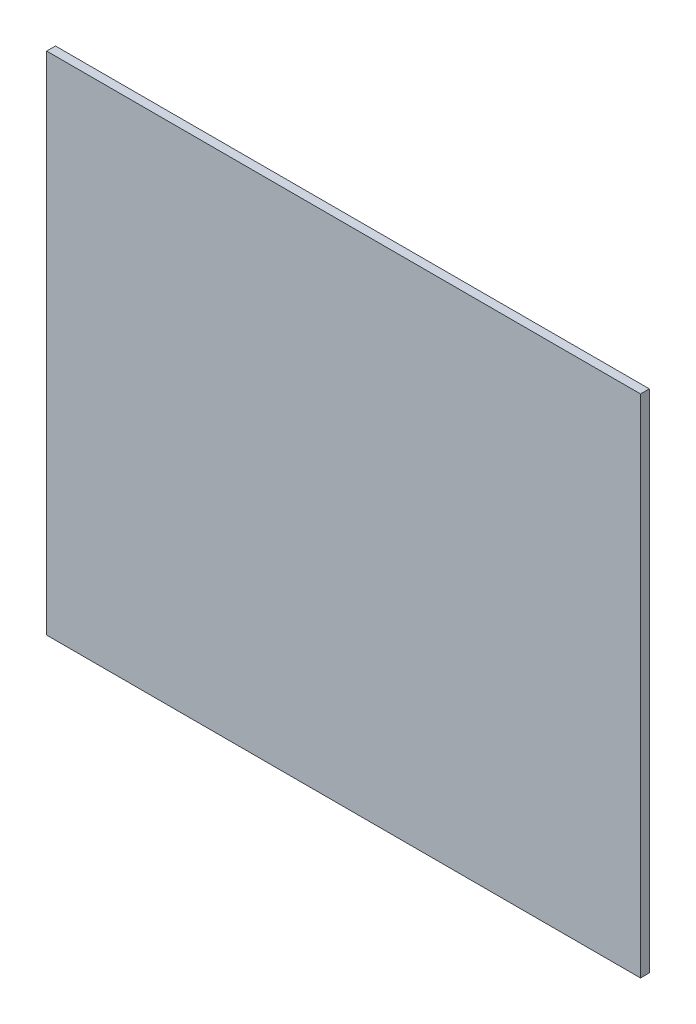
from build123d import *

# Parameters (mm, degrees)
SKETCH1_W           = 270
SKETCH1_H           = 230
BOSS_EXTRUDE1_DEPTH = 4


with BuildPart() as part:
    # Sketch1 → Boss-Extrude1 (new body)
    with BuildSketch(Plane.XY):
        Rectangle(SKETCH1_W, SKETCH1_H)
    extrude(amount=BOSS_EXTRUDE1_DEPTH)


solid = part.part
